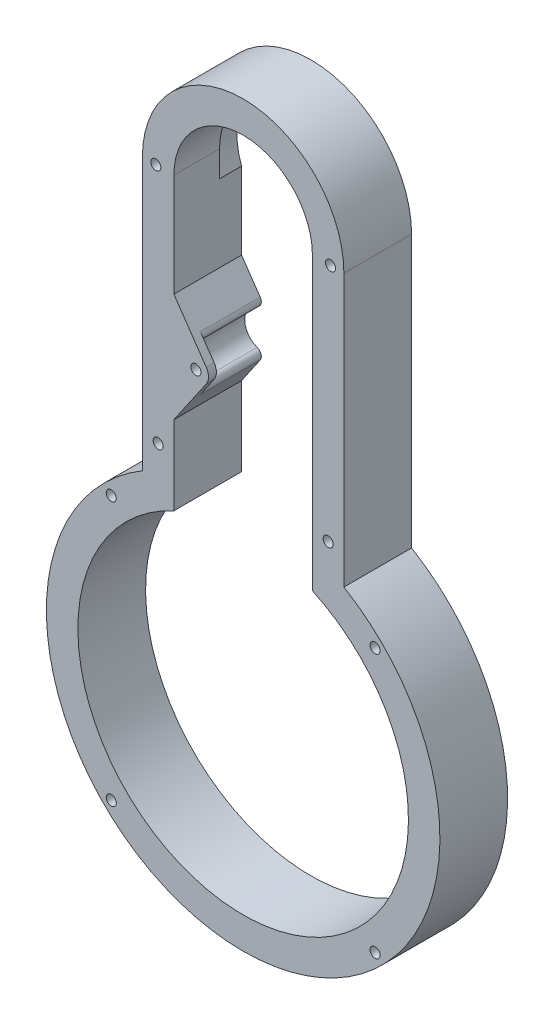
from build123d import *

# Parameters (mm, degrees)
BOSS_EXTRUDE1_DEPTH = 21.5
SKETCH4_R           = 1.6
BOSS_EXTRUDE2_DEPTH = 21.5
SKETCH5_R           = 6
CUT_EXTRUDE1_DEPTH  = 19
FILLET1_R           = 2
CUT_EXTRUDE2_START  = -7
SKETCH6_R           = 23.5
CUT_EXTRUDE2_DEPTH  = 7
SKETCH7_R           = 1.6
CUT_EXTRUDE3_DEPTH  = 252.345877229
SKETCH8_R           = 1.6
CUT_EXTRUDE4_DEPTH  = 252.345877229


with BuildPart() as part:
    # Sketch1 → Boss-Extrude1 (new body)
    with BuildSketch(Plane.XY):
        with BuildLine():
            Line((-32, -126.313409495), (-32, -40))
            ThreePointArc((-32, -40), (0, -8), (32, -40))
            Line((32, -40), (32, -126.313409495))
            ThreePointArc((32, -126.313409495), (0, -242.5), (-32, -126.313409495))
        make_face()
        with BuildLine():
            Line((-22, -132.331876479), (-22, -40))
            ThreePointArc((-22, -40), (0, -18), (22, -40))
            Line((22, -40), (22, -132.331876479))
            ThreePointArc((22, -132.331876479), (0, -232.5), (-22, -132.331876479))
        make_face(mode=Mode.SUBTRACT)
    extrude(amount=BOSS_EXTRUDE1_DEPTH)

    # Sketch4 → Boss-Extrude2 (add)
    with BuildSketch(Plane.XY.offset(21.5)):
        with BuildLine():
            ThreePointArc((-11.702312758, -92.263903456), (-11, -90), (-11.702312758, -87.736096544))
            Line((-11.702312758, -87.736096544), (-22, -72.736096544))
            Line((-22, -72.736096544), (-22, -107.263903456))
            Line((-22, -107.263903456), (-11.702312758, -92.263903456))
        make_face()
        with Locations((-15, -90)):
            Circle(SKETCH4_R, mode=Mode.SUBTRACT)
    extrude(amount=-BOSS_EXTRUDE2_DEPTH)

    # Sketch5 → Cut-Extrude1 (cut)
    with BuildSketch(Plane(origin=(0, 0, 0), x_dir=(-1, 0, 0), z_dir=(0, 0, -1))):
        with Locations((15, -90)):
            Circle(SKETCH5_R)
    extrude(amount=-CUT_EXTRUDE1_DEPTH, mode=Mode.SUBTRACT)

    # Fillet1
    fillet1_edges = [part.edges().sort_by_distance(p)[0] for p in [
        (-14.233433769, -84.049170124, 9.5),
        (-14.233433769, -95.950829876, 9.5),
    ]]
    fillet(fillet1_edges, radius=FILLET1_R)

    # Sketch6 → Cut-Extrude2 (cut)
    with BuildSketch(Plane(origin=(0, 0, 0), x_dir=(-1, 0, 0), z_dir=(0, 0, -1)).offset(CUT_EXTRUDE2_START)):
        with Locations((0, -40)):
            Circle(SKETCH6_R)
    extrude(amount=CUT_EXTRUDE2_DEPTH, mode=Mode.SUBTRACT)

    # Sketch7 → Cut-Extrude3 (cut, through all)
    with BuildSketch(Plane(origin=(0, 0, 0), x_dir=(-1, 0, 0), z_dir=(0, 0, -1))):
        with Locations((41.896076785, -221.896076785)):
            Circle(SKETCH7_R)
        with Locations((-41.896076785, -221.896076785)):
            Circle(SKETCH7_R)
        with Locations((-41.896076785, -138.103923215)):
            Circle(SKETCH7_R)
        with Locations((41.896076785, -138.103923215)):
            Circle(SKETCH7_R)
    extrude(amount=-CUT_EXTRUDE3_DEPTH, mode=Mode.SUBTRACT)

    # Sketch8 → Cut-Extrude4 (cut, through all)
    with BuildSketch(Plane(origin=(0, 0, 0), x_dir=(-1, 0, 0), z_dir=(0, 0, -1))):
        with Locations((27.75, -40)):
            Circle(SKETCH8_R)
        with Locations((27, -116.313409495)):
            Circle(SKETCH8_R)
        with Locations(Location((-27.75, -40, 0), (0, 0, 180))):
            Circle(SKETCH8_R)
        with Locations(Location((-27, -116.313409495, 0), (0, 0, 180))):
            Circle(SKETCH8_R)
    extrude(amount=-CUT_EXTRUDE4_DEPTH, mode=Mode.SUBTRACT)


solid = part.part
